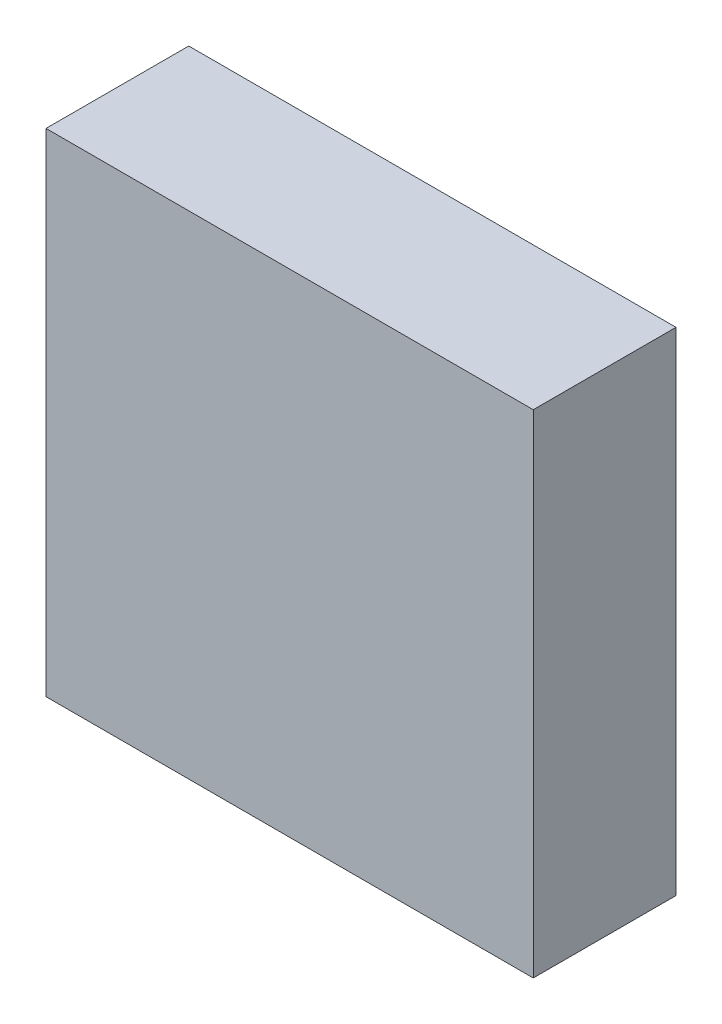
from build123d import *

# Parameters (mm, degrees)
SKETCH1_W      = 1257.3
SKETCH1_H      = 368.3
EXTRUDE1_DEPTH = 1270


with BuildPart() as part:
    # Sketch1 → Extrude1 (new body)
    with BuildSketch(Plane(origin=(0, 0, 0), x_dir=(1, 0, 0), z_dir=(0, 1, 0))):
        with Locations((628.65, 184.15)):
            Rectangle(SKETCH1_W, SKETCH1_H)
    extrude(amount=EXTRUDE1_DEPTH)


solid = part.part
